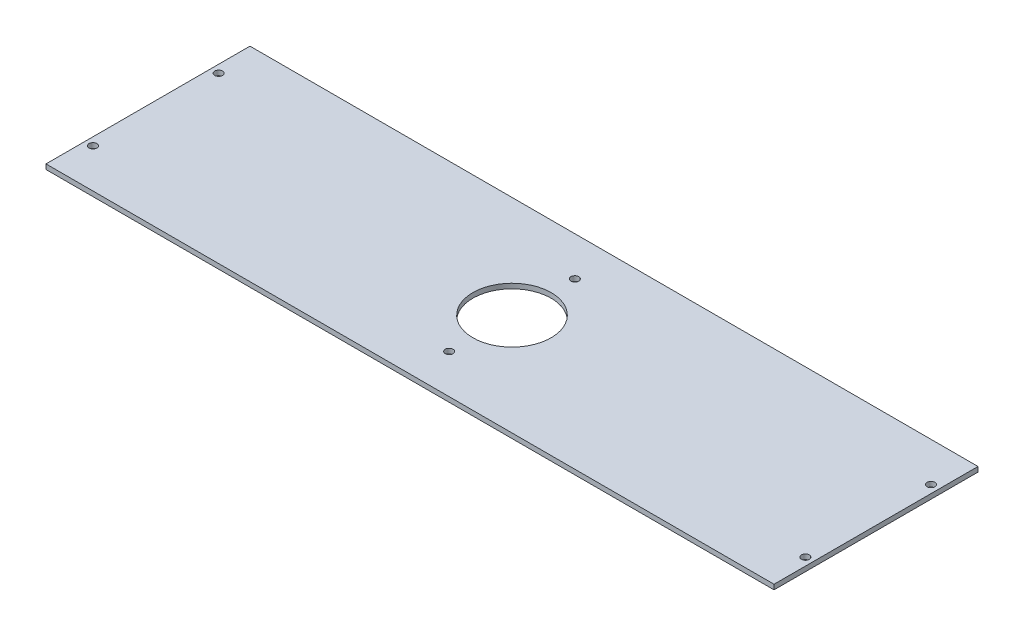
from build123d import *

# Parameters (mm, degrees)
SKETCH1_W           = 372
SKETCH1_H           = 104.22
BOSS_EXTRUDE1_DEPTH = 2.5
SKETCH2_R           = 2
CUT_EXTRUDE1_DEPTH  = 10
SKETCH3_R           = 2
CUT_EXTRUDE2_DEPTH  = 10
CUT_EXTRUDE3_DEPTH  = 26


with BuildPart() as part:
    # Sketch1 → Boss-Extrude1 (new body)
    with BuildSketch(Plane(origin=(0, 0, 0), x_dir=(1, 0, 0), z_dir=(0, 1, 0))):
        with Locations((72.169818201, 7.186191072)):
            Rectangle(SKETCH1_W, SKETCH1_H)
    extrude(amount=BOSS_EXTRUDE1_DEPTH)

    # Sketch2 → Cut-Extrude1 (cut)
    with BuildSketch(Plane(origin=(0, 2.5, 0), x_dir=(1, 0, 0), z_dir=(0, 1, 0))):
        with BuildLine():
            ThreePointArc((-107.830181799, 39.296191072), (-108.415968237, 40.710404634), (-109.830181799, 41.296191072))
            Line((-109.830181799, 41.296191072), (-109.830181799, 39.296191072))
            Line((-109.830181799, 39.296191072), (-111.830181799, 39.296191072))
            ThreePointArc((-111.830181799, 39.296191072), (-109.830181799, 37.296191072), (-107.830181799, 39.296191072))
        make_face()
        with BuildLine():
            Line((-109.830181799, 39.296191072), (-109.830181799, 41.296191072))
            ThreePointArc((-109.830181799, 41.296191072), (-111.244395361, 40.710404634), (-111.830181799, 39.296191072))
            Line((-111.830181799, 39.296191072), (-109.830181799, 39.296191072))
        make_face()
        with BuildLine():
            ThreePointArc((256.169818201, 39.296191072), (255.584031763, 40.710404634), (254.169818201, 41.296191072))
            Line((254.169818201, 41.296191072), (254.169818201, 39.296191072))
            Line((254.169818201, 39.296191072), (256.169818201, 39.296191072))
        make_face()
        with BuildLine():
            Line((254.169818201, 39.296191072), (254.169818201, 41.296191072))
            ThreePointArc((254.169818201, 41.296191072), (252.755604639, 37.88197751), (256.169818201, 39.296191072))
            Line((256.169818201, 39.296191072), (254.169818201, 39.296191072))
        make_face()
        with Locations(Location((-109.830181799, -24.923808928, 0), (0, 0, 270))):
            Circle(SKETCH2_R)
        with Locations(Location((254.169818201, -24.923808928, 0), (0, 0, 270))):
            Circle(SKETCH2_R)
    extrude(amount=-CUT_EXTRUDE1_DEPTH, mode=Mode.SUBTRACT)

    # Sketch3 → Cut-Extrude2 (cut)
    with BuildSketch(Plane(origin=(0, 2.5, 0), x_dir=(1, 0, 0), z_dir=(0, 1, 0))):
        with Locations(Location((72.169818201, 39.296191072, 0), (0, 0, 270))):
            Circle(SKETCH3_R)
        with Locations(Location((72.169818201, -24.923808928, 0), (0, 0, 270))):
            Circle(SKETCH3_R)
    extrude(amount=-CUT_EXTRUDE2_DEPTH, mode=Mode.SUBTRACT)

    # Sketch4 → Cut-Extrude3 (cut)
    with BuildSketch(Plane(origin=(0, 2.5, 0), x_dir=(1, 0, 0), z_dir=(0, 1, 0))):
        with BuildLine():
            ThreePointArc((92.169818201, 7.186191072), (86.311953825, 21.328326696), (72.169818201, 27.186191072))
            Line((72.169818201, 27.186191072), (72.169818201, -12.813808928))
            ThreePointArc((72.169818201, -12.813808928), (86.311953825, -6.955944552), (92.169818201, 7.186191072))
        make_face()
        with BuildLine():
            Line((72.169818201, -12.813808928), (72.169818201, 27.186191072))
            ThreePointArc((72.169818201, 27.186191072), (52.169818201, 7.186191072), (72.169818201, -12.813808928))
        make_face()
    extrude(amount=-CUT_EXTRUDE3_DEPTH, mode=Mode.SUBTRACT)


solid = part.part
